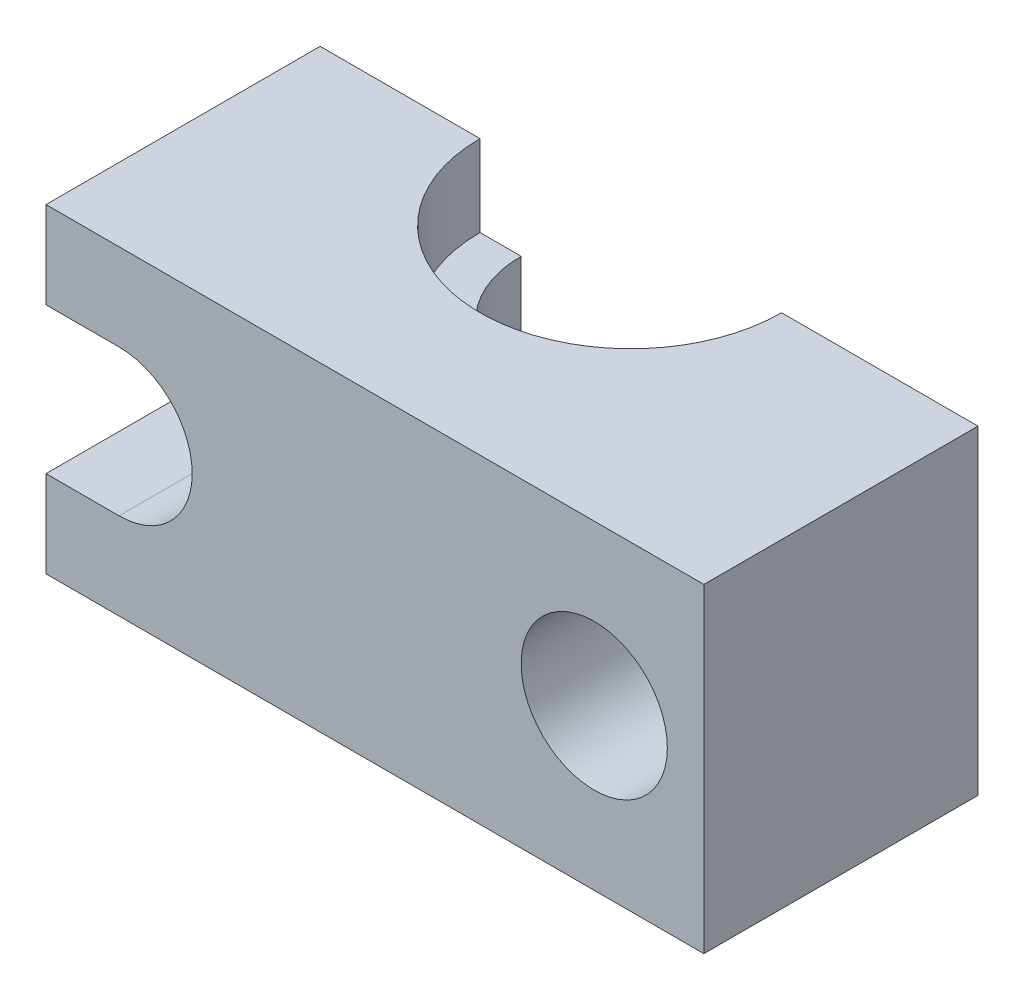
from build123d import *

# Parameters (mm, degrees)
SKETCH1_W           = 36
SKETCH1_H           = 17.5
BOSS_EXTRUDE1_DEPTH = 15
SKETCH2_R           = 1.75
CUT_EXTRUDE1_DEPTH  = 15
SKETCH3_R           = 4
CUT_EXTRUDE2_DEPTH  = 11


with BuildPart() as part:
    # Sketch1 → Boss-Extrude1 (new body)
    with BuildSketch(Plane.XY):
        with Locations((38.848522366, 25.293010486)):
            Rectangle(SKETCH1_W, SKETCH1_H)
    extrude(amount=BOSS_EXTRUDE1_DEPTH)

    # Sketch2 → Cut-Extrude1 (cut)
    with BuildSketch(Plane.XY.offset(15)):
        with Locations((50.848522366, 25.293010486)):
            Circle(SKETCH2_R)
        with Locations((24.848522366, 25.293010486)):
            Circle(SKETCH2_R)
    extrude(amount=-CUT_EXTRUDE1_DEPTH, mode=Mode.SUBTRACT)

    # Sketch3 → Cut-Extrude2 (cut)
    with BuildSketch(Plane.XY.offset(15)):
        with Locations((50.848522366, 25.293010486)):
            Circle(SKETCH3_R)
        with BuildLine():
            Line((24.848522366, 29.293010486), (20.848522366, 29.293010486))
            Line((20.848522366, 29.293010486), (20.848522366, 21.293010486))
            Line((20.848522366, 21.293010486), (24.848522366, 21.293010486))
            ThreePointArc((24.848522366, 21.293010486), (28.848522366, 25.293010486), (24.848522366, 29.293010486))
        make_face()
    extrude(amount=-CUT_EXTRUDE2_DEPTH, mode=Mode.SUBTRACT)

    # Sketch4 → Cut-Revolve1 (revolve, cut)
    with BuildSketch(Plane.ZY.offset(-37.848522366)):
        Polygon((0, 16.543010486), (0, 34.293010486), (8.25, 34.293010486), (8.25, 29.593010486), (6, 29.593010486), (6, 24.993010486), (8.25, 24.993010486), (8.25, 21.993010486), (6, 21.993010486), (6, 16.543010486), align=None)
    revolve(axis=Axis((37.848522366, 16.543010486, 0), (0, 1, 0)), mode=Mode.SUBTRACT)


solid = part.part
